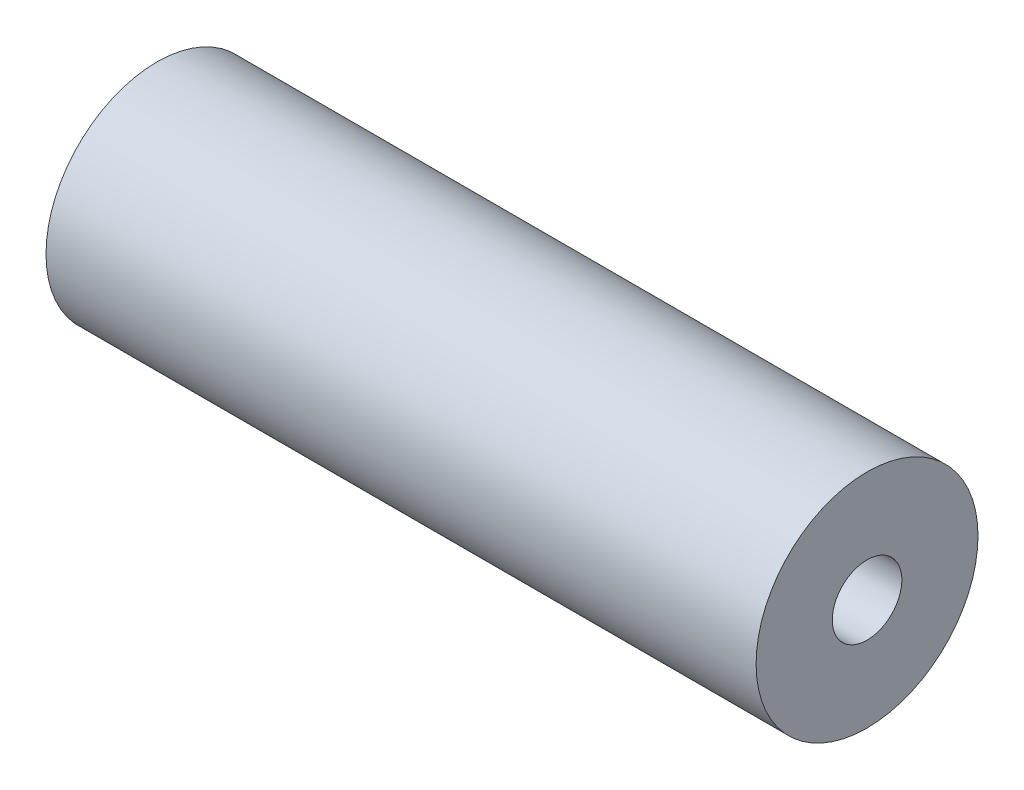
from build123d import *

# Parameters (mm, degrees)
SKETCH1_W = 50.8
SKETCH1_H = 5.4483


with BuildPart() as part:
    # Sketch1 → Revolve1 (revolve)
    with BuildSketch(Plane(origin=(0, 0, 0), x_dir=(1, 0, 0), z_dir=(0, 1, 0)), mode=Mode.PRIVATE) as revolve1_sk:
        with Locations((0, 5.21335)):
            Rectangle(SKETCH1_W, SKETCH1_H)
    revolve(revolve1_sk.sketch.rotate(Axis((-72.893991897, 0, 0), (1, 0, 0)), 180), axis=Axis((-72.893991897, 0, 0), (1, 0, 0)))


solid = part.part
